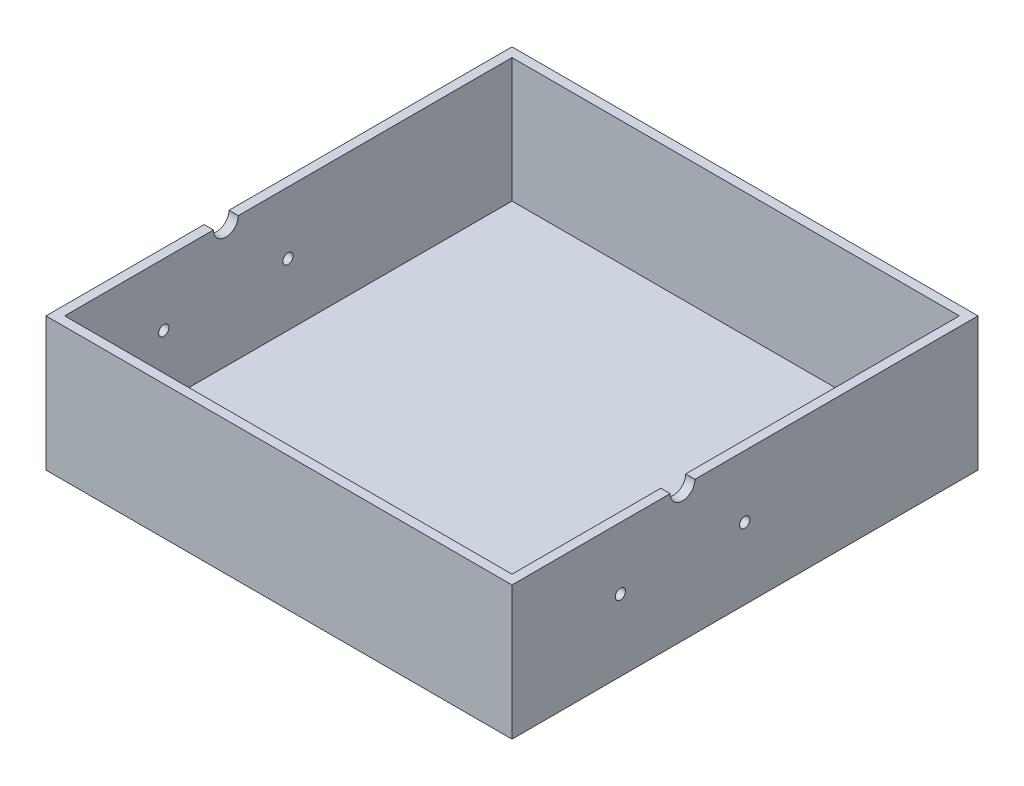
from build123d import *

# Parameters (mm, degrees)
SKETCH_1_W          = 150
SKETCH_1_H          = 150
EXTRUDE_1_DEPTH     = 3
SKETCH_2_W          = 150
SKETCH_2_H          = 150
SKETCH_2_W_2        = 144
SKETCH_2_H_2        = 144
EXTRUDE_2_DEPTH     = 40
SKETCH_3_R          = 4
SKETCH_3_R_2        = 1.65
CUT_EXTRUDE_1_DEPTH = 174.130008953


with BuildPart() as part:
    # 草图1 → 凸台-拉伸1 (new body)
    with BuildSketch(Plane(origin=(0, 0, 0), x_dir=(1, 0, 0), z_dir=(0, 1, 0))):
        Rectangle(SKETCH_1_W, SKETCH_1_H)
    extrude(amount=EXTRUDE_1_DEPTH)

    # 草图2 → 凸台-拉伸2 (add)
    with BuildSketch(Plane(origin=(0, 3, 0), x_dir=(1, 0, 0), z_dir=(0, 1, 0))):
        Rectangle(SKETCH_2_W, SKETCH_2_H)
        Rectangle(SKETCH_2_W_2, SKETCH_2_H_2, mode=Mode.SUBTRACT)
    extrude(amount=EXTRUDE_2_DEPTH)

    # 草图3 → 切除-拉伸1 (cut, through all)
    with BuildSketch(Plane(origin=(75, 0, 0), x_dir=(0, 0, -1), z_dir=(1, 0, 0))):
        with Locations((-20.1, 43)):
            Circle(SKETCH_3_R)
        with Locations((-0.1, 23)):
            Circle(SKETCH_3_R_2)
        with Locations((-40.1, 23)):
            Circle(SKETCH_3_R_2)
    extrude(amount=-CUT_EXTRUDE_1_DEPTH, mode=Mode.SUBTRACT)


solid = part.part
